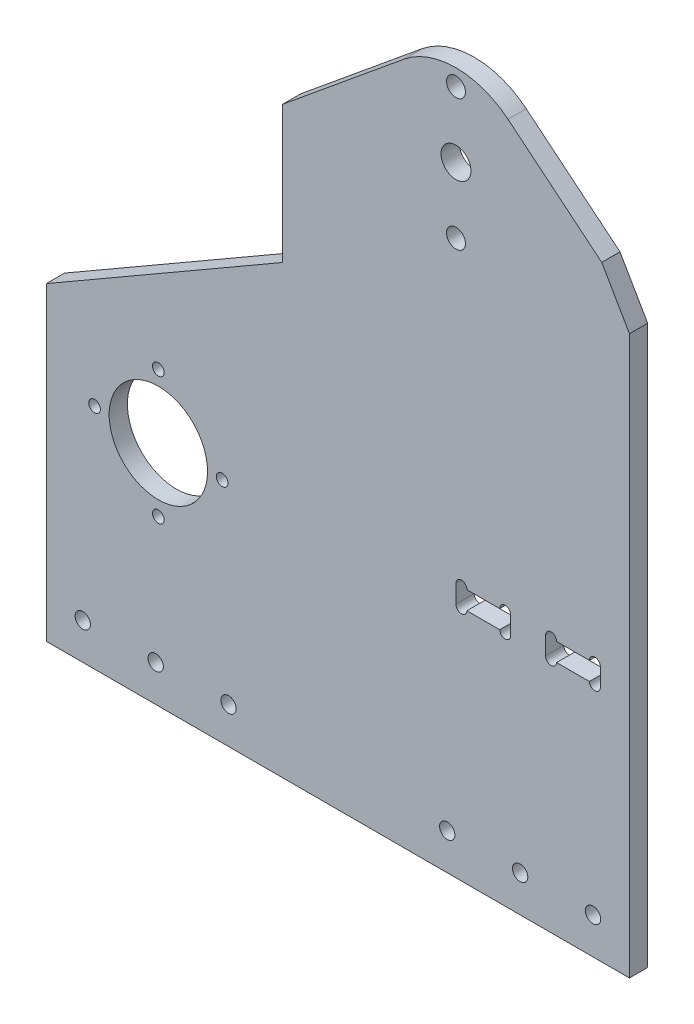
from build123d import *
from build123d.topology import SkipClean

# Parameters (mm, degrees)
SKETCH_1_R          = 2.6
SKETCH_1_R_2        = 4.1
EXTRUDE_1_DEPTH     = 5
SKETCH_2_R          = 13.5
SKETCH_2_R_2        = 1.6
EXTRUDE_2_DEPTH     = 5
CUT_EXTRUDE_START   = -10
SKETCH_3_R          = 2.6
CUT_EXTRUDE_1_DEPTH = 10
CUT_EXTRUDE_3_DEPTH = 5
SKETCH_6_R          = 1.5
CUT_EXTRUDE_5_DEPTH = 204.859657608
SKETCH_7_W          = 14.99904054
SKETCH_7_H          = 5
CUT_EXTRUDE_6_DEPTH = 204.859657608
SKETCH_8_W          = 64.8
SKETCH_8_H          = 20
EXTRUDE_3_DEPTH     = 5
SKETCH_9_R          = 2.1
CUT_EXTRUDE_7_DEPTH = 5


with BuildPart() as part:
    # 草图1 → 凸台-拉伸1 (new body)
    with BuildSketch(Plane.XY):
        with BuildLine():
            Line((-42.831, 7.053044662), (-8.38125, 20.880724327))
            ThreePointArc((-8.38125, 20.880724327), (0, 22.5), (8.38125, 20.880724327))
            Line((8.38125, 20.880724327), (42.831, 7.053044662))
            ThreePointArc((42.831, 7.053044662), (46.29585578, 4.257017735), (47.6, 0))
            Line((47.6, 0), (47.6, -170))
            Line((47.6, -170), (-47.6, -170))
            Line((-47.6, -170), (-47.6, 0))
            ThreePointArc((-47.6, 0), (-46.29585578, 4.257017735), (-42.831, 7.053044662))
        make_face()
        with Locations((-40, 0)):
            Circle(SKETCH_1_R, mode=Mode.SUBTRACT)
        with Locations(Location((40, 0, 0), (0, 0, 180))):
            Circle(SKETCH_1_R, mode=Mode.SUBTRACT)
        Circle(SKETCH_1_R_2, mode=Mode.SUBTRACT)
    extrude(amount=EXTRUDE_1_DEPTH)

    # 草图2 → 凸台-拉伸2 (add)
    with BuildSketch(Plane.XY.offset(5)):
        Polygon((-47.6, -47.587702557), (-47.6, -150), (-112.4, -150), (-112.4, -85), align=None)
        with Locations((-81.662414855, -107.5)):
            Circle(SKETCH_2_R, mode=Mode.SUBTRACT)
        with Locations((-81.662414855, -90)):
            Circle(SKETCH_2_R_2, mode=Mode.SUBTRACT)
        with Locations((-64.162414855, -107.5)):
            Circle(SKETCH_2_R_2, mode=Mode.SUBTRACT)
        with Locations((-81.662414855, -125)):
            Circle(SKETCH_2_R_2, mode=Mode.SUBTRACT)
        with Locations((-99.162414855, -107.5)):
            Circle(SKETCH_2_R_2, mode=Mode.SUBTRACT)
    extrude(amount=-EXTRUDE_2_DEPTH)

    # 草图3 → 切除-拉伸1 (cut)
    with SkipClean():  # the faces are left unmerged after this step: merging them gives an invalid solid
        with BuildSketch(Plane.XY.offset(5).offset(CUT_EXTRUDE_START)):
            with Locations((0, 18)):
                Circle(SKETCH_3_R)
            with Locations((0, -18)):
                Circle(SKETCH_3_R)
            with BuildLine():
                Line((-14.287145834, 17.381814172), (-47.6, -10))
                Line((-47.6, -10), (-95.969286822, 101.060273712))
                Line((-95.969286822, 101.060273712), (-90.307154963, 103.526261511))
                Line((-90.307154963, 103.526261511), (99.481091757, 68.842428386))
                Line((99.481091757, 68.842428386), (47.6, -10))
                Line((47.6, -10), (14.287145834, 17.381814172))
                ThreePointArc((14.287145834, 17.381814172), (0, 22.5), (-14.287145834, 17.381814172))
            make_face()
        extrude(amount=CUT_EXTRUDE_1_DEPTH, mode=Mode.SUBTRACT)

    # 草图5 → 切除-拉伸3 (cut)
    with SkipClean():  # the faces are left unmerged after this step: merging them gives an invalid solid
        with BuildSketch(Plane.XY.offset(5)):
            Polygon((40, -3.753108435), (47.6, -16.916694572), (47.6, -10), align=None)
        extrude(amount=-CUT_EXTRUDE_3_DEPTH, mode=Mode.SUBTRACT)

    # 草图6 → 切除-拉伸5 (cut, through all)
    with SkipClean():  # the faces are left unmerged after this step: merging them gives an invalid solid
        with BuildSketch(Plane.XY.offset(5)):
            with Locations((1.5, -105)):
                Circle(SKETCH_6_R)
            with Locations((1.5, -100)):
                Circle(SKETCH_6_R)
            with Locations((13.5, -105)):
                Circle(SKETCH_6_R)
            with Locations((13.5, -100)):
                Circle(SKETCH_6_R)
            with Locations((38.1, -105)):
                Circle(SKETCH_6_R)
            with Locations((26.1, -105)):
                Circle(SKETCH_6_R)
            with Locations((26.1, -100)):
                Circle(SKETCH_6_R)
            with Locations((38.1, -100)):
                Circle(SKETCH_6_R)
        extrude(amount=-CUT_EXTRUDE_5_DEPTH, mode=Mode.SUBTRACT)

    # 草图7 → 切除-拉伸6 (cut, through all)
    with SkipClean():  # the faces are left unmerged after this step: merging them gives an invalid solid
        with BuildSketch(Plane.XY.offset(5)):
            with Locations((7.5, -102.537933644)):
                Rectangle(SKETCH_7_W, SKETCH_7_H)
            with Locations((32.1, -102.537933644)):
                Rectangle(SKETCH_7_W, SKETCH_7_H)
        extrude(amount=-CUT_EXTRUDE_6_DEPTH, mode=Mode.SUBTRACT)

    # 草图8 → 凸台-拉伸3 (add)
    with SkipClean():  # the faces are left unmerged after this step: merging them gives an invalid solid
        with BuildSketch(Plane.XY.offset(5)):
            with Locations((-80, -160)):
                Rectangle(SKETCH_8_W, SKETCH_8_H)
        extrude(amount=-EXTRUDE_3_DEPTH)

    # 草图9 → 切除-拉伸7 (cut)
    with SkipClean():  # the faces are left unmerged after this step: merging them gives an invalid solid
        with BuildSketch(Plane.XY.offset(5)):
            with Locations((-102.4, -160)):
                Circle(SKETCH_9_R)
            with Locations((-82.4, -160)):
                Circle(SKETCH_9_R)
            with Locations((-62.4, -160)):
                Circle(SKETCH_9_R)
            with Locations(Location((-2.4, -160, 0), (0, 0, 180))):
                Circle(SKETCH_9_R)
            with Locations(Location((17.6, -160, 0), (0, 0, 180))):
                Circle(SKETCH_9_R)
            with Locations(Location((37.6, -160, 0), (0, 0, 180))):
                Circle(SKETCH_9_R)
        extrude(amount=-CUT_EXTRUDE_7_DEPTH, mode=Mode.SUBTRACT)


solid = part.part
